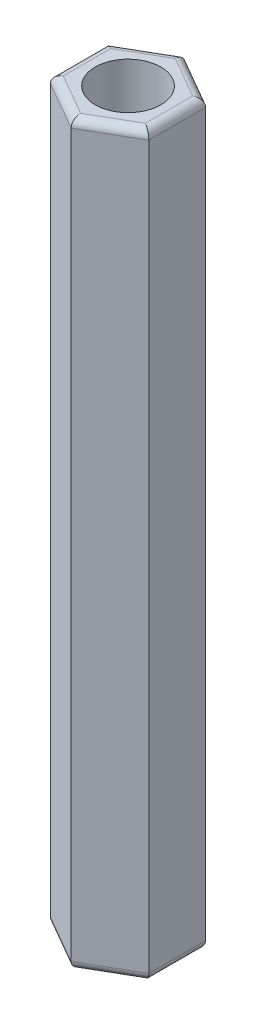
from build123d import *

# Parameters (mm, degrees)
SKETCH_1_R      = 2
EXTRUDE_1_DEPTH = 45
FILLET_1_R      = 0.5


with BuildPart() as part:
    # 草图1 → 凸台-拉伸1 (new body)
    with BuildSketch(Plane(origin=(0, 0, 0), x_dir=(1, 0, 0), z_dir=(0, 1, 0))):
        Polygon((3, -1.732050808), (3, 1.732050808), (0, 3.464101615), (-3, 1.732050808), (-3, -1.732050808), (0, -3.464101615), align=None)
        with Locations(Location((0, 0, 0), (0, 0, 90))):
            Circle(SKETCH_1_R, mode=Mode.SUBTRACT)
    extrude(amount=EXTRUDE_1_DEPTH)

    # 圆角1
    fillet_1_edges = [part.edges().sort_by_distance(p)[0] for p in [
        (1.5, 45, -2.598076211),
        (-1.5, 45, -2.598076211),
        (-3, 45, 0),
        (-1.5, 45, 2.598076211),
        (1.5, 45, 2.598076211),
        (-1.5, 0, 2.598076211),
        (-3, 0, 0),
        (-1.5, 0, -2.598076211),
        (1.5, 0, -2.598076211),
        (3, 0, 0),
        (1.5, 0, 2.598076211),
        (3, 45, 0),
    ]]
    fillet(fillet_1_edges, radius=FILLET_1_R)


solid = part.part
